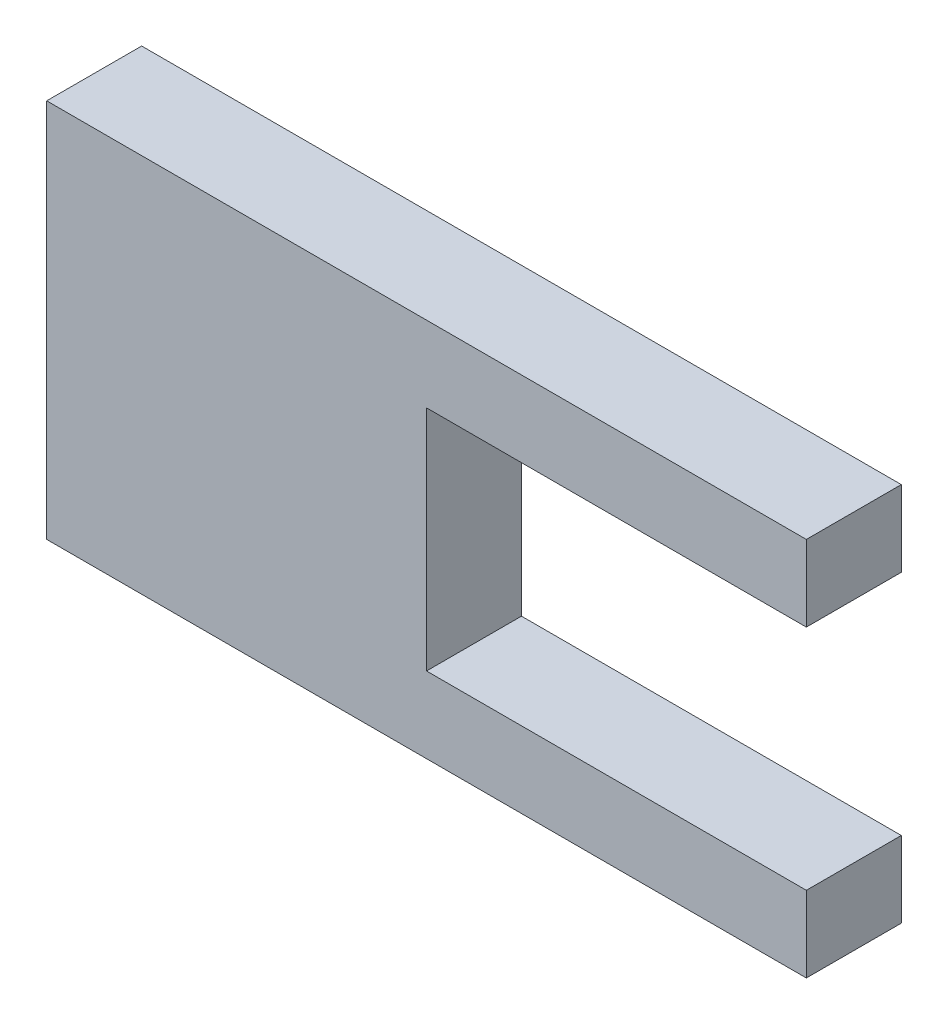
from build123d import *

# Parameters (mm, degrees)
BOSS_EXTRUDE1_DEPTH = 5


with BuildPart() as part:
    # Sketch2 → Boss-Extrude1 (new body)
    with BuildSketch(Plane(origin=(0, 0, 0), x_dir=(0, 1, 0), z_dir=(0, 0, 1))):
        Polygon((-10, 10), (10, 10), (10, -10), (10, -30), (6, -30), (6, -10), (-6, -10), (-6, -30), (-10, -30), (-10, -10), align=None)
    extrude(amount=BOSS_EXTRUDE1_DEPTH)


solid = part.part
